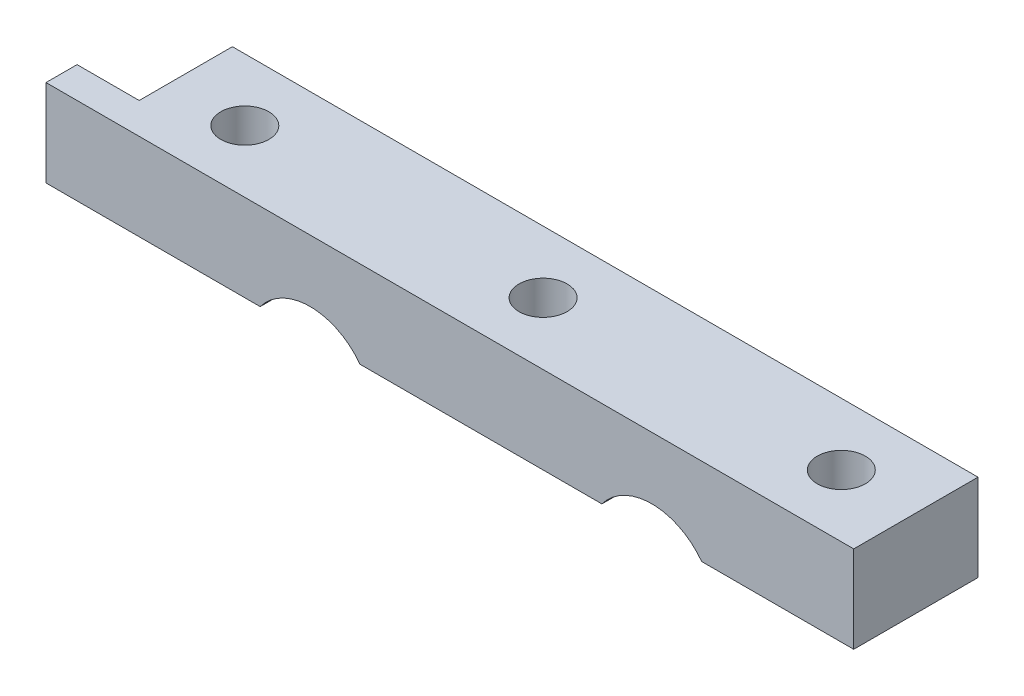
from build123d import *

# Parameters (mm, degrees)
BOSS_EXTRUDE1_DEPTH          = 12.7
SKETCH2_W                    = 3.175
SKETCH2_H                    = 8.89
BOSS_EXTRUDE2_DEPTH          = 6.35
F_10_0_1935_DIAMETER_HOLE1_D = 4.9149


with BuildPart() as part:
    # Sketch1 → Boss-Extrude1 (new body)
    with BuildSketch(Plane.XY):
        with BuildLine():
            Line((38.1, 33.6042), (38.1, 24.7142))
            Line((38.1, 24.7142), (22.561451151, 24.7142))
            ThreePointArc((22.561451151, 24.7142), (17.4625, 27.2796), (12.363548849, 24.7142))
            Line((12.363548849, 24.7142), (-12.363548849, 24.7142))
            ThreePointArc((-12.363548849, 24.7142), (-17.4625, 27.2796), (-22.561451151, 24.7142))
            Line((-22.561451151, 24.7142), (-38.1, 24.7142))
            Line((-38.1, 24.7142), (-38.1, 33.6042))
            Line((-38.1, 33.6042), (38.1, 33.6042))
        make_face()
    extrude(amount=BOSS_EXTRUDE1_DEPTH)

    # Sketch2 → Boss-Extrude2 (add)
    with BuildSketch(Plane.ZY.offset(38.1)):
        with Locations((11.1125, 29.1592)):
            Rectangle(SKETCH2_W, SKETCH2_H)
    extrude(amount=BOSS_EXTRUDE2_DEPTH)

    # #10 (0.1935) Diameter Hole1 (through all)
    with Locations(Plane(origin=(-30.48, 33.6042, 6.35), x_dir=(0, 0, 1), z_dir=(0, 1, 0))):
        with Locations((0, 0), (0, 30.48), (0, 60.96)):
            Hole(F_10_0_1935_DIAMETER_HOLE1_D / 2)


solid = part.part
